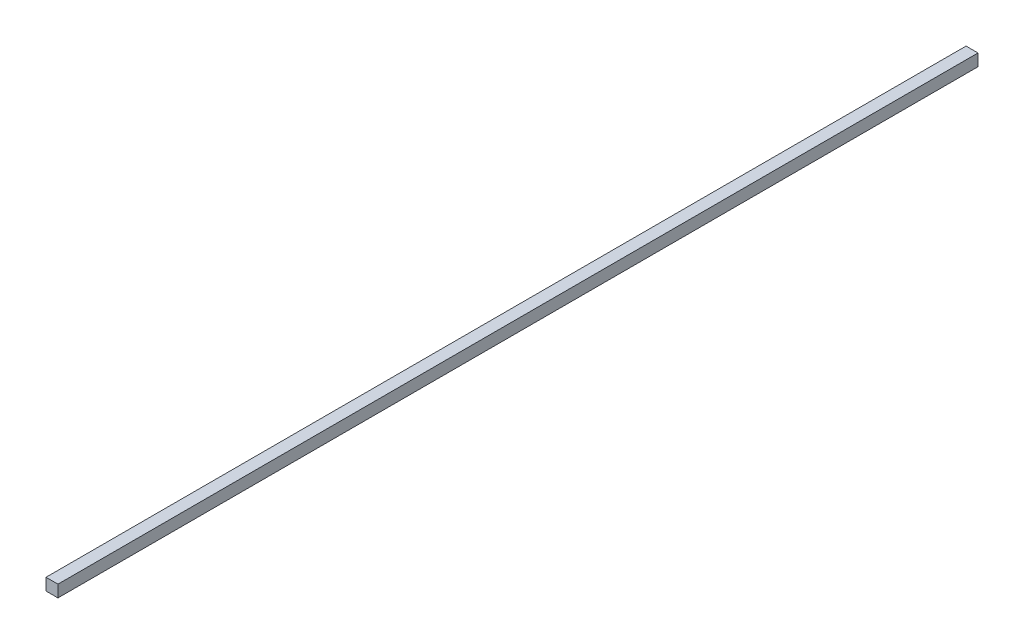
from build123d import *

# Parameters (mm, degrees)
SKETCH1_W           = 10
SKETCH1_H           = 10
BOSS_EXTRUDE1_DEPTH = 770


with BuildPart() as part:
    # Sketch1 → Boss-Extrude1 (new body)
    with BuildSketch(Plane.XY):
        with Locations((-38.25, 9.25)):
            Rectangle(SKETCH1_W, SKETCH1_H)
    extrude(amount=BOSS_EXTRUDE1_DEPTH)


solid = part.part
